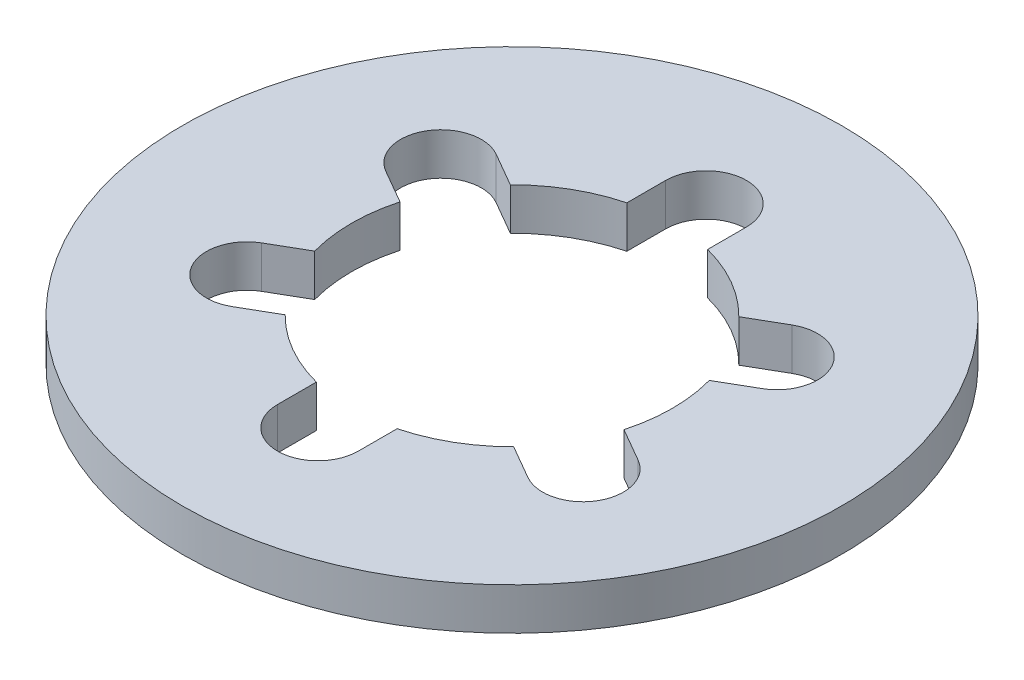
from build123d import *

# Parameters (mm, degrees)
SKETCH1_R           = 2.825
SKETCH1_R_2         = 1.375
BOSS_EXTRUDE1_DEPTH = 0.36
CUT_EXTRUDE1_DEPTH  = 5.011340175
CIRPATTERN1_COUNT   = 3
CIRPATTERN1_ANGLE   = 120


with BuildPart() as part:
    # Sketch1 → Boss-Extrude1 (new body)
    with BuildSketch(Plane(origin=(0, 0, 0), x_dir=(1, 0, 0), z_dir=(0, 1, 0))):
        Circle(SKETCH1_R)
        Circle(SKETCH1_R_2, mode=Mode.SUBTRACT)
    extrude(amount=BOSS_EXTRUDE1_DEPTH)

    # Sketch2 → Cut-Extrude1 (cut, through all)
    with BuildSketch(Plane(origin=(0, 0.36, 0), x_dir=(1, 0, 0), z_dir=(0, 1, 0))):
        with BuildLine():
            Line((-0.346155251, -1.663778464), (-0.346155251, 1.663778464))
            ThreePointArc((-0.346155251, 1.663778464), (0, 2.009933715), (0.346155251, 1.663778464))
            Line((0.346155251, 1.663778464), (0.346155251, -1.663778464))
            ThreePointArc((0.346155251, -1.663778464), (0, -2.009933715), (-0.346155251, -1.663778464))
        make_face()
    cut_extrude1 = extrude(amount=-CUT_EXTRUDE1_DEPTH, mode=Mode.SUBTRACT)

    # CirPattern1: Cut-Extrude1 ×3 about axis
    cirpattern1_axis = Axis((0, 0.36, 0), (0, -1, 0))
    for i in range(1, CIRPATTERN1_COUNT):
        add(cut_extrude1.rotate(cirpattern1_axis, i * CIRPATTERN1_ANGLE / (CIRPATTERN1_COUNT - 1)), mode=Mode.SUBTRACT)


solid = part.part
